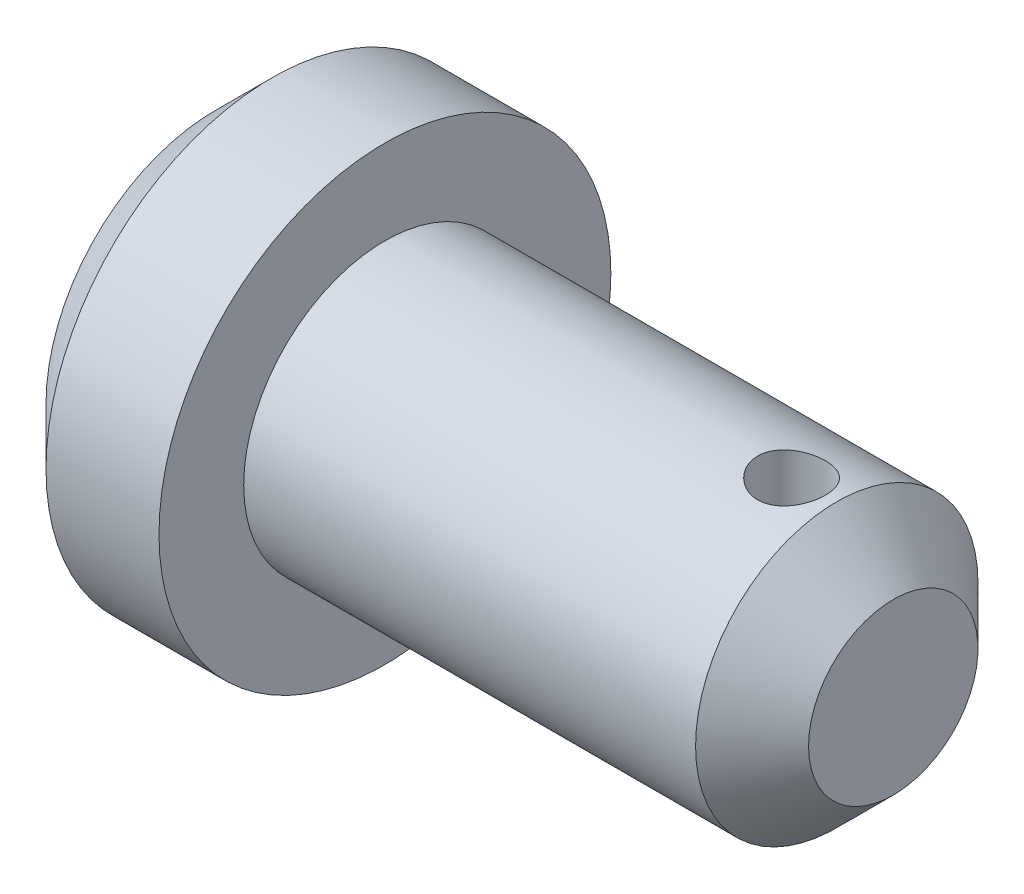
from build123d import *

# Parameters (mm, degrees)
SKETCH_1_W          = 90
SKETCH_1_H          = 25
SKETCH_1_W_2        = 30
SKETCH_1_H_2        = 40
CHAMFER_1_SIZE      = 10
SKETCH_2_R          = 6
CUT_EXTRUDE_1_DEPTH = 250


with BuildPart() as part:
    # 草圖1 → 旋轉1 (revolve)
    with BuildSketch(Plane.XY, mode=Mode.PRIVATE) as revolve_1_sk:
        with Locations((75, 12.5)):
            Rectangle(SKETCH_1_W, SKETCH_1_H)
        with Locations((15, 20)):
            Rectangle(SKETCH_1_W_2, SKETCH_1_H_2)
    revolve(revolve_1_sk.sketch.rotate(Axis((0, 0, 0), (1, 0, 0)), 90), axis=Axis((0, 0, 0), (1, 0, 0)))

    # 導角1
    chamfer_1_edges = [part.edges().sort_by_distance(p)[0] for p in [
        (0, 0, -40),
        (120, 0, -25),
    ]]
    chamfer(chamfer_1_edges, length=CHAMFER_1_SIZE)

    # 草圖2 → 除料-伸長1 (cut, symmetric)
    with BuildSketch(Plane(origin=(0, 0, 0), x_dir=(1, 0, 0), z_dir=(0, 1, 0))):
        with Locations(Location((102, 0, 0), (0, 0, 90))):
            Circle(SKETCH_2_R)
    extrude(amount=CUT_EXTRUDE_1_DEPTH, both=True, mode=Mode.SUBTRACT)


solid = part.part
